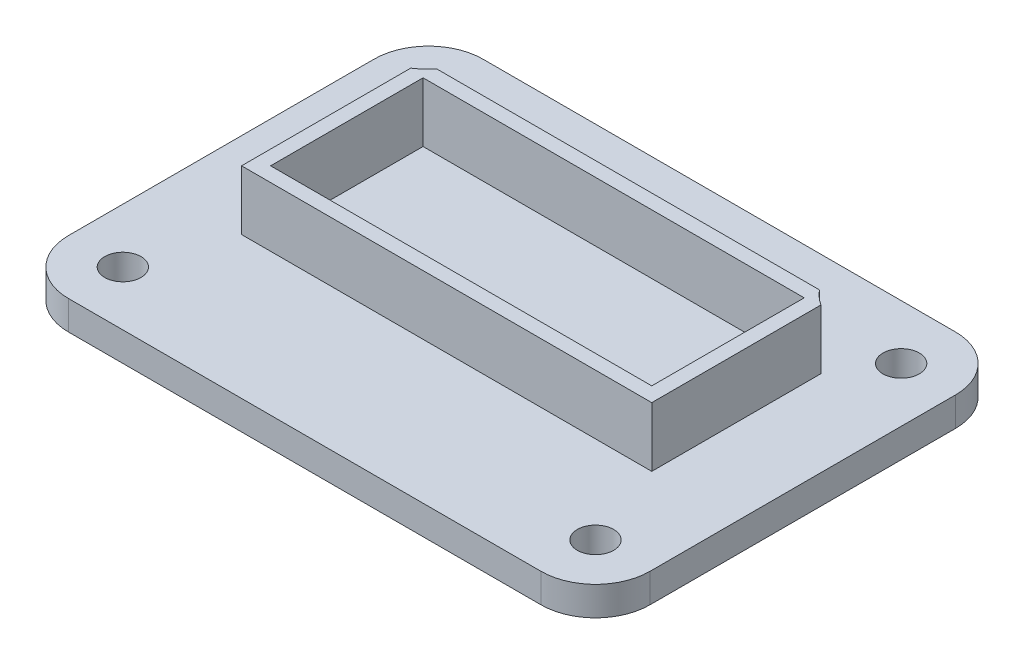
from build123d import *

# Parameters (mm, degrees)
EXTRUDE_1_DEPTH     = 4
SKETCH_1_3_R        = 2.5
CUT_EXTRUDE_1_DEPTH = 5
SKETCH_1_4_W        = 52.5
SKETCH_1_4_H        = 21
EXTRUDE_2_DEPTH     = 12.2


with BuildPart() as part:
    # Эскиз1 → Бобышка-Вытянуть1 (new body)
    with BuildSketch(Plane(origin=(0, 0, 0), x_dir=(1, 0, 0), z_dir=(0, 1, 0))):
        with BuildLine():
            Line((-65.1, 49.6), (0, 49.6))
            ThreePointArc((0, 49.6), (5.303300859, 47.403300859), (7.5, 42.1))
            Line((7.5, 42.1), (7.5, 0))
            ThreePointArc((7.5, 0), (5.303300859, -5.303300859), (0, -7.5))
            Line((0, -7.5), (-65.1, -7.5))
            ThreePointArc((-65.1, -7.5), (-70.403300859, -5.303300859), (-72.6, 0))
            Line((-72.6, 0), (-72.6, 42.1))
            ThreePointArc((-72.6, 42.1), (-70.403300859, 47.403300859), (-65.1, 49.6))
        make_face()
    extrude(amount=EXTRUDE_1_DEPTH)

    # Эскиз1<3> → Вырез-Вытянуть1 (cut)
    with BuildSketch(Plane(origin=(0, 0, 0), x_dir=(1, 0, 0), z_dir=(0, 1, 0))):
        with Locations((-65.1, 42.1)):
            Circle(SKETCH_1_3_R)
        with Locations((0, 42.1)):
            Circle(SKETCH_1_3_R)
        Circle(SKETCH_1_3_R)
        with Locations((-65.1, 0)):
            Circle(SKETCH_1_3_R)
    extrude(amount=CUT_EXTRUDE_1_DEPTH, mode=Mode.SUBTRACT)

    # Эскиз1<4> → Бобышка-Вытянуть2 (add)
    with BuildSketch(Plane(origin=(0, 0, 0), x_dir=(1, 0, 0), z_dir=(0, 1, 0))):
        with BuildLine():
            Line((-6.204635364, 37.05), (-58.895364636, 37.05))
            ThreePointArc((-58.895364636, 37.05), (-59.779658065, 36.125557625), (-60.8, 35.35389001))
            Line((-60.8, 35.35389001), (-60.8, 12.05))
            Line((-60.8, 12.05), (-4.3, 12.05))
            Line((-4.3, 12.05), (-4.3, 35.35389001))
            ThreePointArc((-4.3, 35.35389001), (-5.320341935, 36.125557625), (-6.204635364, 37.05))
        make_face()
        with Locations((-32.55, 24.55)):
            Rectangle(SKETCH_1_4_W, SKETCH_1_4_H, mode=Mode.SUBTRACT)
    extrude(amount=EXTRUDE_2_DEPTH)


solid = part.part
